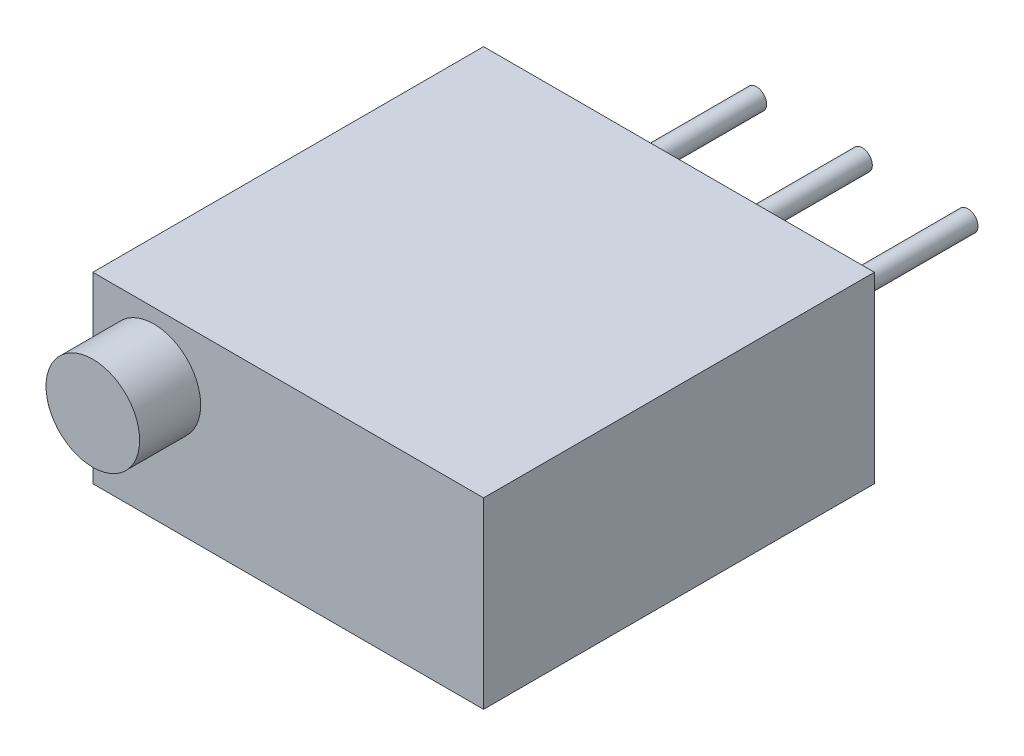
from build123d import *

# Parameters (mm, degrees)
SKETCH_1_W      = 9.6
SKETCH_1_H      = 9.6
EXTRUDE_1_DEPTH = 4.5
SKETCH_3_R      = 0.25
EXTRUDE_3_DEPTH = 4.5
SKETCH_4_R      = 1.15
EXTRUDE_4_DEPTH = 1.5


with BuildPart() as part:
    # 草图1 → 拉伸1 (new body)
    with BuildSketch(Plane(origin=(0, 0, 0), x_dir=(1, 0, 0), z_dir=(0, 1, 0))):
        Rectangle(SKETCH_1_W, SKETCH_1_H)
    extrude(amount=EXTRUDE_1_DEPTH)

    # 草图3 → 拉伸3 (add)
    with BuildSketch(Plane(origin=(0, 0, -4.8), x_dir=(-1, 0, 0), z_dir=(0, 0, -1))):
        with Locations(Location((0, 2.25, 0), (0, 0, 180))):
            Circle(SKETCH_3_R)
        with Locations(Location((2.595978382, 2.25, 0), (0, 0, 180))):
            Circle(SKETCH_3_R)
        with Locations(Location((-2.595978382, 2.25, 0), (0, 0, 180))):
            Circle(SKETCH_3_R)
    extrude(amount=EXTRUDE_3_DEPTH)

    # 草图4 → 拉伸4 (add)
    with BuildSketch(Plane.XY.offset(4.8)):
        with Locations(Location((-3.3, 3, 0), (0, 0, 180))):
            Circle(SKETCH_4_R)
    extrude(amount=EXTRUDE_4_DEPTH)


solid = part.part
